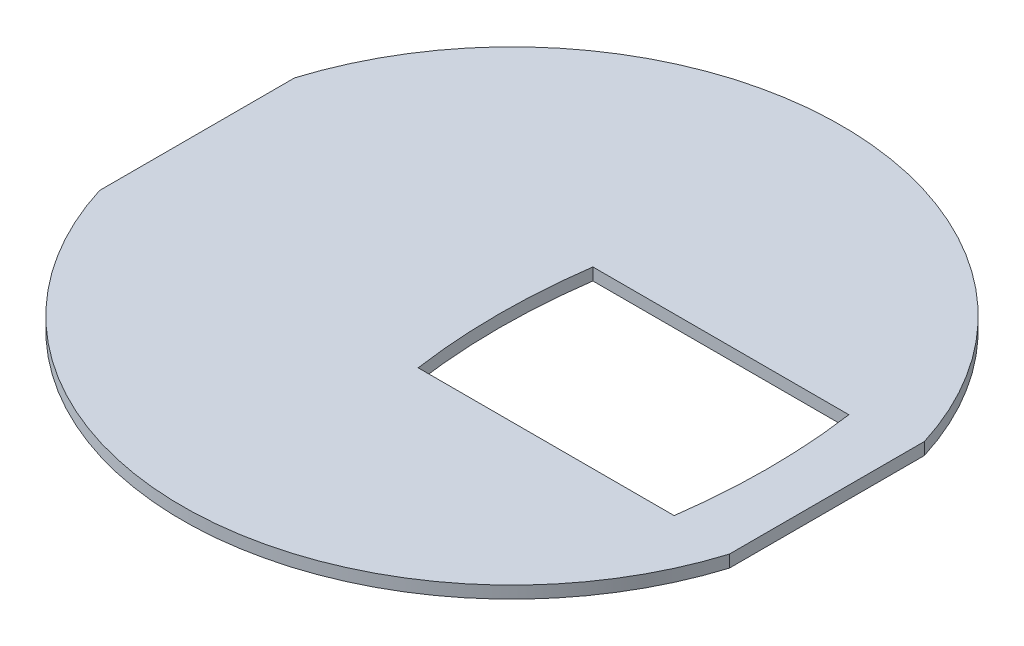
from build123d import *

# Parameters (mm, degrees)
Y_KSEKLIK_EKSTR_ZYON1_DEPTH = 3
KES_EKSTR_ZYON2_DEPTH       = 5.5


with BuildPart() as part:
    # Çizim1 → Yükseklik-Ekstrüzyon1 (new body)
    with BuildSketch(Plane(origin=(0, 0, 0), x_dir=(1, 0, 0), z_dir=(0, 1, 0))):
        with BuildLine():
            Line((-77.5, 24), (-77.5, -24))
            ThreePointArc((-77.5, -24), (0, -81.131066799), (77.5, -24))
            Line((77.5, -24), (77.5, 24))
            ThreePointArc((77.5, 24), (0, 81.131066799), (-77.5, 24))
        make_face()
    extrude(amount=Y_KSEKLIK_EKSTR_ZYON1_DEPTH)

    # Çizim4 → Kes-Ekstrüzyon2 (cut)
    with BuildSketch(Plane(origin=(0, 3, 0), x_dir=(1, 0, 0), z_dir=(0, 1, 0))):
        with BuildLine():
            Line((62.5, 20.404916559), (-0.5, 20.404916559))
            ThreePointArc((-0.5, 20.404916559), (-2.024235699, -1.095083441), (-0.5, -22.595083441))
            Line((-0.5, -22.595083441), (62.5, -22.595083441))
            ThreePointArc((62.5, -22.595083441), (64.017330872, -1.095083441), (62.5, 20.404916559))
        make_face()
    extrude(amount=-KES_EKSTR_ZYON2_DEPTH, mode=Mode.SUBTRACT)


solid = part.part
